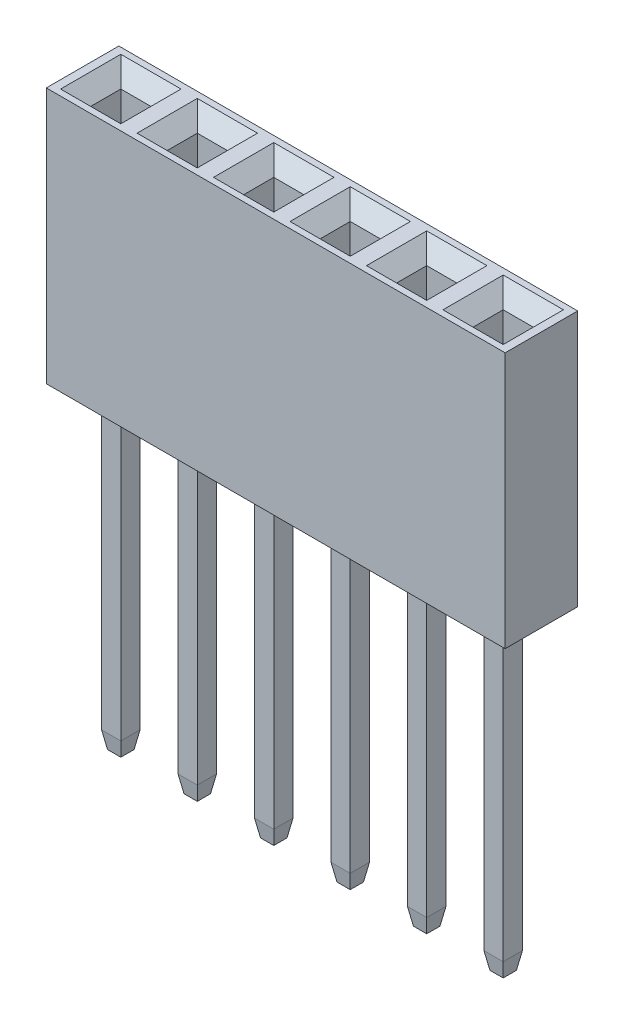
from build123d import *

# Parameters (mm, degrees)
SKETCH2_W                  = 15.24
SKETCH2_H                  = 2.41
BOSS_EXTRUDE1_DEPTH        = 8.51
SKETCH5_W                  = 1
SKETCH5_H                  = 1
CUT_EXTRUDE1_DEPTH         = 5
CHAMFER1_SIZE              = 0.5
LPATTERN3_COUNT            = 6
LPATTERN3_PITCH            = 2.54
CHAMFER1_OF_LPATTERN3_SIZE = 0.5
SKETCH11_W                 = 0.64
SKETCH11_H                 = 0.64
BOSS_EXTRUDE2_DEPTH        = 9.92
LPATTERN4_COUNT            = 6
LPATTERN4_PITCH            = 2.54


with BuildPart() as part:
    # Sketch2 → Boss-Extrude1 (new body)
    with BuildSketch(Plane(origin=(0, 0, 0), x_dir=(1, 0, 0), z_dir=(0, 1, 0))):
        with Locations((6.35, 0)):
            Rectangle(SKETCH2_W, SKETCH2_H)
    extrude(amount=BOSS_EXTRUDE1_DEPTH)

    # Sketch5 → Cut-Extrude1 (cut)
    with BuildSketch(Plane(origin=(0, 8.51, 0), x_dir=(1, 0, 0), z_dir=(0, 1, 0))):
        Rectangle(SKETCH5_W, SKETCH5_H)
    cut_extrude1 = extrude(amount=-CUT_EXTRUDE1_DEPTH, mode=Mode.SUBTRACT)

    # Chamfer1
    chamfer1_edges = [part.edges().sort_by_distance(p)[0] for p in [
        (-0.5, 8.51, 0),
        (0, 8.51, 0.5),
        (0.5, 8.51, 0),
        (0, 8.51, -0.5),
    ]]
    chamfer(chamfer1_edges, length=CHAMFER1_SIZE)

    # LPattern3: Cut-Extrude1 ×6
    with Locations(*[(i * LPATTERN3_PITCH, 0, 0) for i in range(1, LPATTERN3_COUNT)]):
        add(cut_extrude1, mode=Mode.SUBTRACT)

    # Chamfer1 of LPattern3
    chamfer1_of_lpattern3_edges = [part.edges().sort_by_distance(p)[0] for p in [
        (2.04, 8.51, 0),
        (2.54, 8.51, 0.5),
        (3.04, 8.51, 0),
        (2.54, 8.51, -0.5),
        (4.58, 8.51, 0),
        (5.08, 8.51, 0.5),
        (5.58, 8.51, 0),
        (5.08, 8.51, -0.5),
        (7.12, 8.51, 0),
        (7.62, 8.51, 0.5),
        (8.12, 8.51, 0),
        (7.62, 8.51, -0.5),
        (9.66, 8.51, 0),
        (10.16, 8.51, 0.5),
        (10.66, 8.51, 0),
        (10.16, 8.51, -0.5),
        (12.2, 8.51, 0),
        (12.7, 8.51, 0.5),
        (13.2, 8.51, 0),
        (12.7, 8.51, -0.5),
    ]]
    chamfer(chamfer1_of_lpattern3_edges, length=CHAMFER1_OF_LPATTERN3_SIZE)

    # Sketch11 → Boss-Extrude2 (add)
    with BuildSketch(Plane.XZ):
        Rectangle(SKETCH11_W, SKETCH11_H)
    boss_extrude2 = extrude(amount=BOSS_EXTRUDE2_DEPTH)

    # Sketch13 → Loft1 section 0
    with BuildSketch(Plane.XZ.offset(9.92)):
        with BuildLine():
            Line((0.32, -0.32), (0.32, 0.32))
            Line((0.32, 0.32), (-0.32, 0.32))
            Line((-0.32, 0.32), (-0.32, -0.32))
            Line((-0.32, -0.32), (0.32, -0.32))
        make_face()
    # Sketch14 → Loft1 section 1
    with BuildSketch(Plane(origin=(0, -10.49, 0), x_dir=(-1, 0, 0), z_dir=(0, -1, 0))):
        with BuildLine():
            Line((-0.22, 0.22), (0.22, 0.22))
            Line((0.22, 0.22), (0.22, -0.22))
            Line((0.22, -0.22), (-0.22, -0.22))
            Line((-0.22, -0.22), (-0.22, 0.22))
        make_face()
    loft1 = loft()

    # LPattern4: Boss-Extrude2, Loft1 ×6
    with Locations(*[(i * LPATTERN4_PITCH, 0, 0) for i in range(1, LPATTERN4_COUNT)]):
        add(boss_extrude2)
        add(loft1)


solid = part.part
